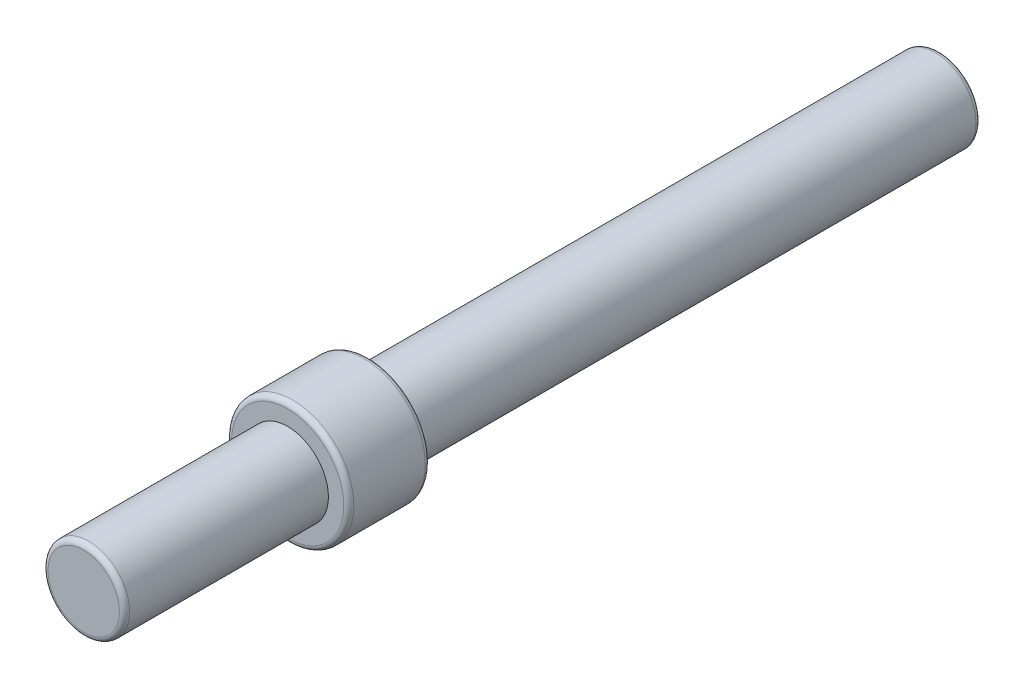
from build123d import *

# Parameters (mm, degrees)
SKETCH_1_R      = 4
EXTRUDE_1_DEPTH = 20
SKETCH_2_R      = 6
EXTRUDE_2_DEPTH = 8
EXTRUDE_START   = 56
SKETCH_3_R      = 4
EXTRUDE_5_DEPTH = 56
FILLET_1_R      = 0.5
FILLET_2_R      = 0.5


with BuildPart() as part:
    # 草图1 → 凸台-拉伸1 (new body)
    with BuildSketch(Plane.XY):
        Circle(SKETCH_1_R)
    extrude(amount=EXTRUDE_1_DEPTH)

    # 草图2 → 凸台-拉伸2 (add)
    with BuildSketch(Plane.XY):
        Circle(SKETCH_2_R)
    extrude(amount=-EXTRUDE_2_DEPTH)

    # 草图3 → 凸台-拉伸5 (add)
    with BuildSketch(Plane(origin=(0, 0, -8), x_dir=(-1, 0, 0), z_dir=(0, 0, -1)).offset(EXTRUDE_START)):
        with Locations(Location((0, 0, 0), (0, 0, 180))):
            Circle(SKETCH_3_R)
    extrude(amount=-EXTRUDE_5_DEPTH)

    # 圆角1
    fillet_1_edges = [part.edges().sort_by_distance(p)[0] for p in [
        (-4, 0, 20),
    ]]
    fillet(fillet_1_edges, radius=FILLET_1_R)

    # 圆角2
    fillet_2_edges = [part.edges().sort_by_distance(p)[0] for p in [
        (-4, 0, -64),
        (-6, 0, 0),
        (-6, 0, -8),
    ]]
    fillet(fillet_2_edges, radius=FILLET_2_R)


solid = part.part
